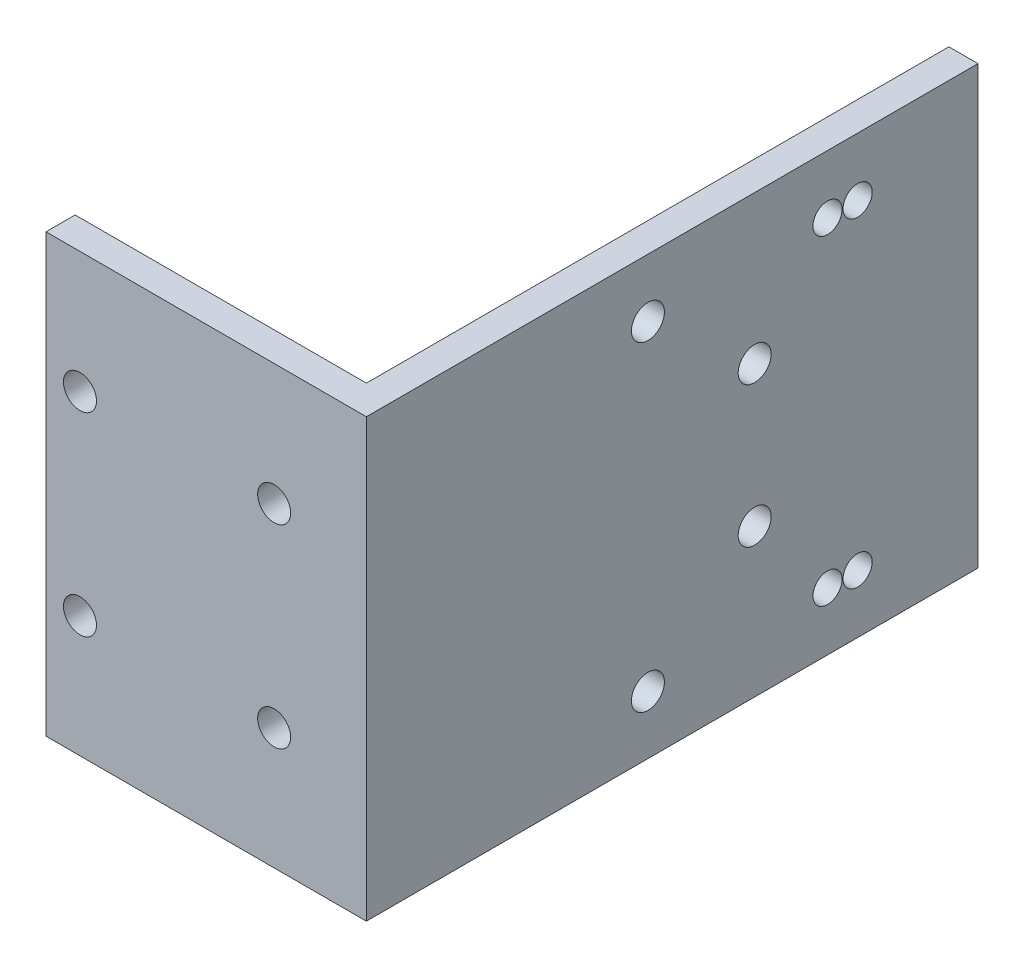
from build123d import *

# Parameters (mm, degrees)
EXTRUDE_1_DEPTH     = 45
CUT_EXTRUDE_1_REACH = 86.161
SKETCH_2_R          = 1.7
CUT_EXTRUDE_2_REACH = 83.939
SKETCH_3_R          = 1.7
SKETCH_3_R_2        = 1.5


with BuildPart() as part:
    # 草图1 → 凸台-拉伸1 (new body)
    with BuildSketch(Plane(origin=(0, 0, 0), x_dir=(1, 0, 0), z_dir=(0, 1, 0))):
        Polygon((0, 0), (30, 0), (30, 60), (33, 60), (33, -3), (0, -3), align=None)
    extrude(amount=EXTRUDE_1_DEPTH)

    # 草图2 → 切除-拉伸1 (cut, up to next)
    with BuildSketch(Plane.XY.offset(3), mode=Mode.PRIVATE) as cut_extrude_1_sk1:
        with Locations((3.5, 32.5)):
            Circle(SKETCH_2_R)
    cut_extrude_1_tool1 = extrude(cut_extrude_1_sk1.sketch, amount=-CUT_EXTRUDE_1_REACH, mode=Mode.PRIVATE) & part.part
    # 草图2 → 切除-拉伸1 (cut, up to next)
    with BuildSketch(Plane.XY.offset(3), mode=Mode.PRIVATE) as cut_extrude_1_sk2:
        with Locations((23.5, 32.5)):
            Circle(SKETCH_2_R)
    cut_extrude_1_tool2 = extrude(cut_extrude_1_sk2.sketch, amount=-CUT_EXTRUDE_1_REACH, mode=Mode.PRIVATE) & part.part
    # 草图2 → 切除-拉伸1 (cut, up to next)
    with BuildSketch(Plane.XY.offset(3), mode=Mode.PRIVATE) as cut_extrude_1_sk3:
        with Locations((23.5, 12.5)):
            Circle(SKETCH_2_R)
    cut_extrude_1_tool3 = extrude(cut_extrude_1_sk3.sketch, amount=-CUT_EXTRUDE_1_REACH, mode=Mode.PRIVATE) & part.part
    # 草图2 → 切除-拉伸1 (cut, up to next)
    with BuildSketch(Plane.XY.offset(3), mode=Mode.PRIVATE) as cut_extrude_1_sk4:
        with Locations((3.5, 12.5)):
            Circle(SKETCH_2_R)
    cut_extrude_1_tool4 = extrude(cut_extrude_1_sk4.sketch, amount=-CUT_EXTRUDE_1_REACH, mode=Mode.PRIVATE) & part.part
    add(cut_extrude_1_tool1.solids().sort_by_distance((3.5, 32.5, 3))[0], mode=Mode.SUBTRACT)
    add(cut_extrude_1_tool2.solids().sort_by_distance((23.5, 32.5, 3))[0], mode=Mode.SUBTRACT)
    add(cut_extrude_1_tool3.solids().sort_by_distance((23.5, 12.5, 3))[0], mode=Mode.SUBTRACT)
    add(cut_extrude_1_tool4.solids().sort_by_distance((3.5, 12.5, 3))[0], mode=Mode.SUBTRACT)

    # 草图3 → 切除-拉伸2 (cut, up to next)
    with BuildSketch(Plane(origin=(33, 0, 0), x_dir=(0, 0, -1), z_dir=(1, 0, 0)), mode=Mode.PRIVATE) as cut_extrude_2_sk1:
        with Locations((26, 6)):
            Circle(SKETCH_3_R)
    cut_extrude_2_tool1 = extrude(cut_extrude_2_sk1.sketch, amount=-CUT_EXTRUDE_2_REACH, mode=Mode.PRIVATE) & part.part
    # 草图3 → 切除-拉伸2 (cut, up to next)
    with BuildSketch(Plane(origin=(33, 0, 0), x_dir=(0, 0, -1), z_dir=(1, 0, 0)), mode=Mode.PRIVATE) as cut_extrude_2_sk2:
        with Locations((26, 39)):
            Circle(SKETCH_3_R)
    cut_extrude_2_tool2 = extrude(cut_extrude_2_sk2.sketch, amount=-CUT_EXTRUDE_2_REACH, mode=Mode.PRIVATE) & part.part
    # 草图3 → 切除-拉伸2 (cut, up to next)
    with BuildSketch(Plane(origin=(33, 0, 0), x_dir=(0, 0, -1), z_dir=(1, 0, 0)), mode=Mode.PRIVATE) as cut_extrude_2_sk3:
        with Locations((37, 15.25)):
            Circle(SKETCH_3_R)
    cut_extrude_2_tool3 = extrude(cut_extrude_2_sk3.sketch, amount=-CUT_EXTRUDE_2_REACH, mode=Mode.PRIVATE) & part.part
    # 草图3 → 切除-拉伸2 (cut, up to next)
    with BuildSketch(Plane(origin=(33, 0, 0), x_dir=(0, 0, -1), z_dir=(1, 0, 0)), mode=Mode.PRIVATE) as cut_extrude_2_sk4:
        with Locations((37, 29.75)):
            Circle(SKETCH_3_R)
    cut_extrude_2_tool4 = extrude(cut_extrude_2_sk4.sketch, amount=-CUT_EXTRUDE_2_REACH, mode=Mode.PRIVATE) & part.part
    # 草图3 → 切除-拉伸2 (cut, up to next)
    with BuildSketch(Plane(origin=(33, 0, 0), x_dir=(0, 0, -1), z_dir=(1, 0, 0)), mode=Mode.PRIVATE) as cut_extrude_2_sk5:
        with Locations((44.5, 39)):
            Circle(SKETCH_3_R_2)
    cut_extrude_2_tool5 = extrude(cut_extrude_2_sk5.sketch, amount=-CUT_EXTRUDE_2_REACH, mode=Mode.PRIVATE) & part.part
    # 草图3 → 切除-拉伸2 (cut, up to next)
    with BuildSketch(Plane(origin=(33, 0, 0), x_dir=(0, 0, -1), z_dir=(1, 0, 0)), mode=Mode.PRIVATE) as cut_extrude_2_sk6:
        with Locations((47.6, 6)):
            Circle(SKETCH_3_R_2)
    cut_extrude_2_tool6 = extrude(cut_extrude_2_sk6.sketch, amount=-CUT_EXTRUDE_2_REACH, mode=Mode.PRIVATE) & part.part
    # 草图3 → 切除-拉伸2 (cut, up to next)
    with BuildSketch(Plane(origin=(33, 0, 0), x_dir=(0, 0, -1), z_dir=(1, 0, 0)), mode=Mode.PRIVATE) as cut_extrude_2_sk7:
        with Locations((47.6, 39)):
            Circle(SKETCH_3_R_2)
    cut_extrude_2_tool7 = extrude(cut_extrude_2_sk7.sketch, amount=-CUT_EXTRUDE_2_REACH, mode=Mode.PRIVATE) & part.part
    # 草图3 → 切除-拉伸2 (cut, up to next)
    with BuildSketch(Plane(origin=(33, 0, 0), x_dir=(0, 0, -1), z_dir=(1, 0, 0)), mode=Mode.PRIVATE) as cut_extrude_2_sk8:
        with Locations((44.5, 6)):
            Circle(SKETCH_3_R_2)
    cut_extrude_2_tool8 = extrude(cut_extrude_2_sk8.sketch, amount=-CUT_EXTRUDE_2_REACH, mode=Mode.PRIVATE) & part.part
    add(cut_extrude_2_tool1.solids().sort_by_distance((33, 6, -26))[0], mode=Mode.SUBTRACT)
    add(cut_extrude_2_tool2.solids().sort_by_distance((33, 39, -26))[0], mode=Mode.SUBTRACT)
    add(cut_extrude_2_tool3.solids().sort_by_distance((33, 15.25, -37))[0], mode=Mode.SUBTRACT)
    add(cut_extrude_2_tool4.solids().sort_by_distance((33, 29.75, -37))[0], mode=Mode.SUBTRACT)
    add(cut_extrude_2_tool5.solids().sort_by_distance((33, 39, -44.5))[0], mode=Mode.SUBTRACT)
    add(cut_extrude_2_tool6.solids().sort_by_distance((33, 6, -47.6))[0], mode=Mode.SUBTRACT)
    add(cut_extrude_2_tool7.solids().sort_by_distance((33, 39, -47.6))[0], mode=Mode.SUBTRACT)
    add(cut_extrude_2_tool8.solids().sort_by_distance((33, 6, -44.5))[0], mode=Mode.SUBTRACT)


solid = part.part
